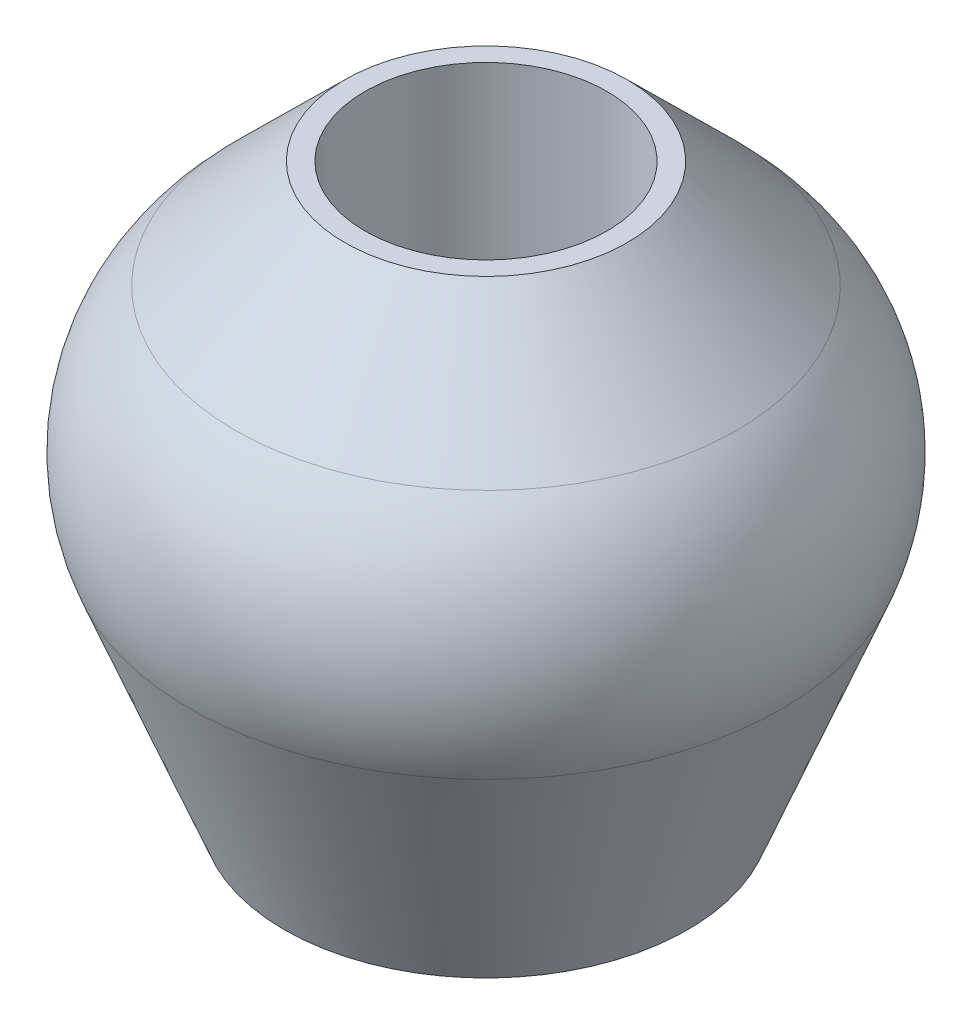
from build123d import *

# Parameters (mm, degrees)
M8_TAPPED_HOLE1_D     = 6
M8_TAPPED_HOLE1_DEPTH = 9.75
FILLET1_R             = 5


with BuildPart() as part:
    # Sketch1 → Revolve1 (revolve)
    with BuildSketch(Plane(origin=(0, 0, 0), x_dir=(0, 0, -1), z_dir=(1, 0, 0))):
        Polygon((0, 0), (5, 0), (8.566874978, 9), (3.5, 14), (0, 14), align=None)
    revolve(axis=Axis((0, 0, 0), (0, 1, 0)))

    # M8 Tapped Hole1
    with Locations(Plane(origin=(0, 14, 0), x_dir=(1, 0, 0), z_dir=(0, 1, 0))):
        with Locations((0, 0)):
            Hole(M8_TAPPED_HOLE1_D / 2, depth=M8_TAPPED_HOLE1_DEPTH)

    # Fillet1
    fillet1_edges = [part.edges().sort_by_distance(p)[0] for p in [
        (0, 9, 8.566874978),
    ]]
    fillet(fillet1_edges, radius=FILLET1_R)


solid = part.part
